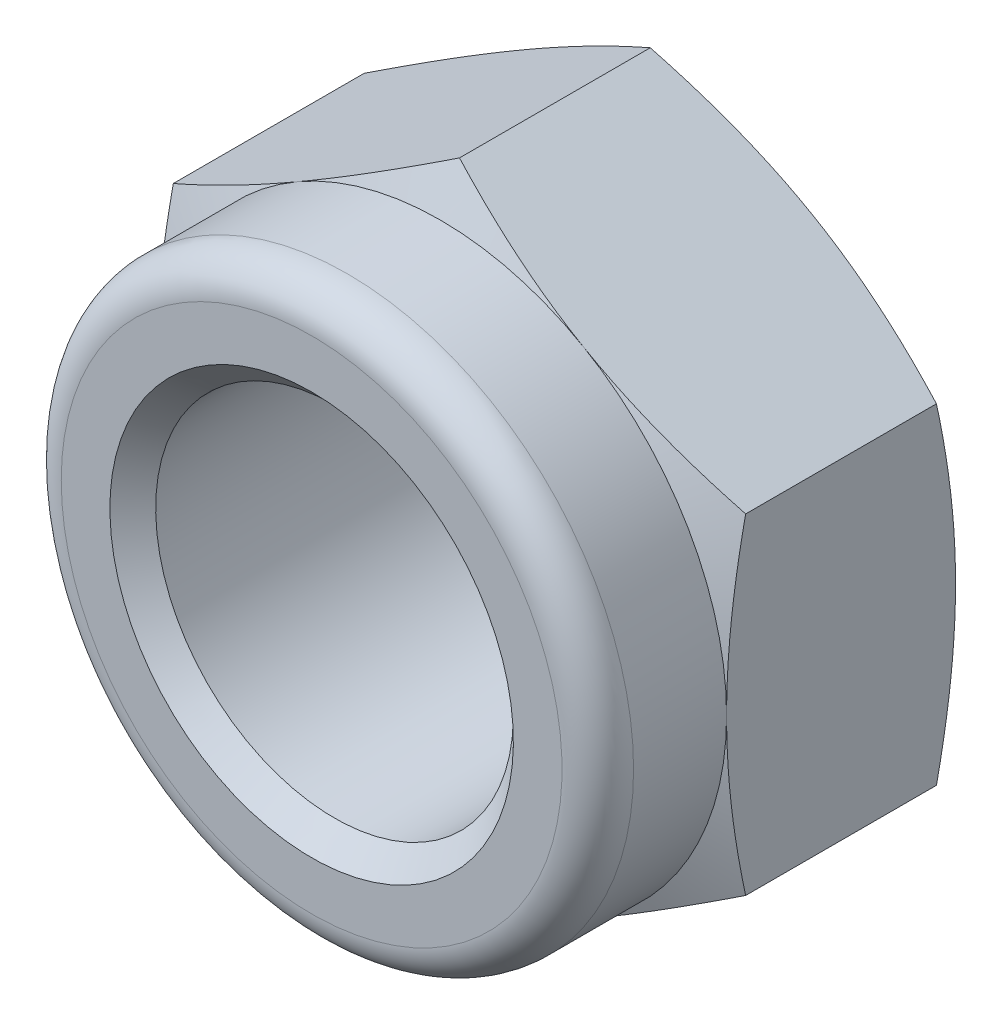
from build123d import *

# Parameters (mm, degrees)
SKETCH1_R           = 2.5
BOSS_EXTRUDE1_DEPTH = 3.2


with BuildPart() as part:
    # Sketch1 → Boss-Extrude1 (new body)
    with BuildSketch(Plane.XY):
        Polygon((0, -4.618802154), (4, -2.309401077), (4, 2.309401077), (0, 4.618802154), (-4, 2.309401077), (-4, -2.309401077), align=None)
        Circle(SKETCH1_R, mode=Mode.SUBTRACT)
    extrude(amount=BOSS_EXTRUDE1_DEPTH)

    # Sketch3 → Revolve1 (revolve)
    with BuildSketch(Plane(origin=(0, 0, 0), x_dir=(0, 0, -1), z_dir=(0, 1, 0))):
        with BuildLine():
            Line((-3.2, 4), (-4.5, 4))
            ThreePointArc((-4.5, 4), (-4.853553391, 3.853553391), (-5, 3.5))
            Line((-5, 3.5), (-5, 2.5))
            Line((-5, 2.5), (-3.2, 2.5))
            Line((-3.2, 2.5), (-3.2, 4))
        make_face()
    revolve(axis=Axis((0, 0, 0), (0, 0, 1)))

    # Sketch2 → Cut-Revolve1 (revolve, cut)
    with BuildSketch(Plane(origin=(0, 0, 0), x_dir=(0, 0, -1), z_dir=(1, 0, 0))):
        Polygon((-3.2, 4.618802154), (-3.2, 4), (-2.933333333, 4.618802154), align=None)
        Polygon((-0.266666667, 4.618802154), (0, 4.618802154), (0, 4), align=None)
        Polygon((-5, 2.5), (-4.68, 2.5), (-5, 2.82), align=None)
        Polygon((0, 2.5), (-0.32, 2.5), (0, 2.82), align=None)
    revolve(axis=Axis((0, 0, 0), (0, 0, 1)), mode=Mode.SUBTRACT)


solid = part.part
